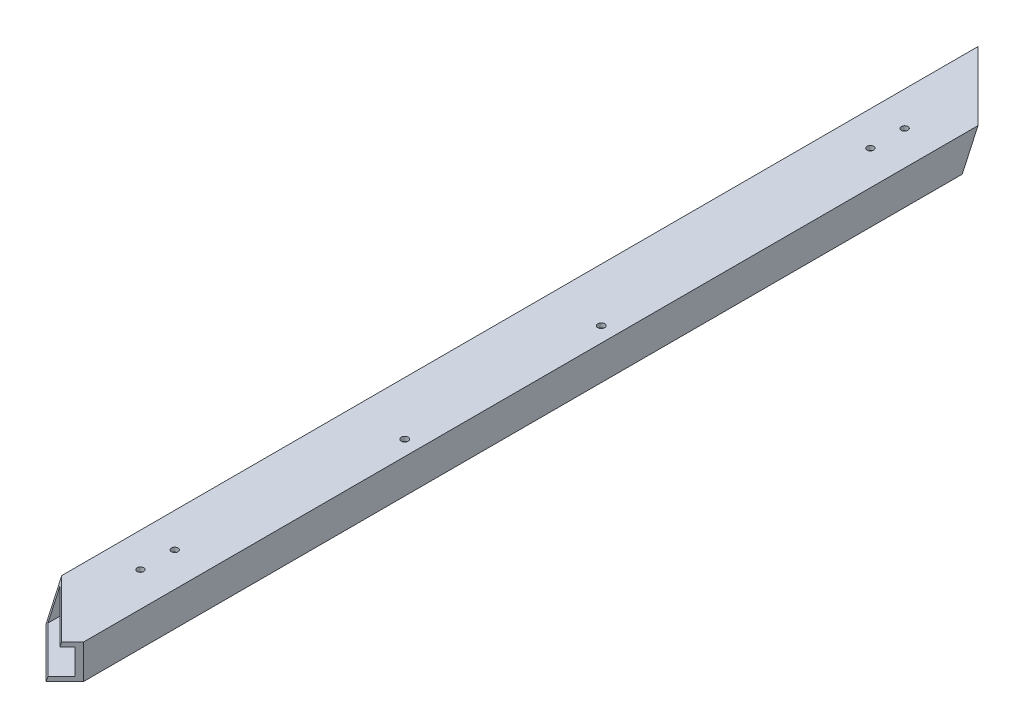
from build123d import *

# Parameters (mm, degrees)
SKETCH1_W                        = 50.8
SKETCH1_H                        = 25.4
SKETCH1_W_2                      = 44.45
SKETCH1_H_2                      = 19.05
BOSS_EXTRUDE1_DEPTH              = 771.9314
CUT_EXTRUDE1_DEPTH               = 771.9314
CUT_EXTRUDE2_DEPTH               = 773.76672179
CUT_EXTRUDE3_DEPTH               = 757.919388013
CUT_EXTRUDE5_DEPTH               = 771.9314
SKETCH7_R                        = 2.4638
CUT_EXTRUDE6_DEPTH               = 730.251464289
SKETCH8_R                        = 2.4638
CUT_EXTRUDE7_DEPTH               = 730.251464289
F_13_64_0_20313_DIAMETER_HOLE1_D = 5.159502


with BuildPart() as part:
    # Sketch1 → Boss-Extrude1 (new body)
    with BuildSketch(Plane.XY):
        Rectangle(SKETCH1_W, SKETCH1_H)
        Rectangle(SKETCH1_W_2, SKETCH1_H_2, mode=Mode.SUBTRACT)
    extrude(amount=BOSS_EXTRUDE1_DEPTH)

    # Sketch2 → Cut-Extrude1 (cut)
    with BuildSketch(Plane(origin=(0, 12.7, 0), x_dir=(1, 0, 0), z_dir=(0, 1, 0))):
        Polygon((-25.4, 0), (25.4, -50.8), (25.4, 0), align=None)
        Polygon((25.4, -771.9314), (-25.4, -721.1314), (-25.4, -771.9314), align=None)
    extrude(amount=-CUT_EXTRUDE1_DEPTH, mode=Mode.SUBTRACT)

    # Sketch3 → Cut-Extrude2 (cut, through all)
    with BuildSketch(Plane(origin=(0, 12.7, 0), x_dir=(1, 0, 0), z_dir=(0, 1, 0))):
        Polygon((-3.3782, -743.1532), (25.4, -714.375), (25.4, -771.9314), (-3.3782, -771.9314), align=None)
    extrude(amount=-CUT_EXTRUDE2_DEPTH, mode=Mode.SUBTRACT)

    # Sketch4 → Cut-Extrude3 (cut, through all)
    with BuildSketch(Plane(origin=(-12.7, 0, -12.7), x_dir=(0, -1, 0), z_dir=(0.7071067811865571, 0, 0.707106781186538))):
        Polygon((-12.7, -17.960512242), (12.7, -26.213472526), (12.7, -17.960512242), align=None)
    extrude(amount=CUT_EXTRUDE3_DEPTH, mode=Mode.SUBTRACT)

    # Sketch6 → Cut-Extrude5 (cut)
    with BuildSketch(Plane(origin=(369.8875, 0, 369.8875), x_dir=(0.7071067811865437, 0, -0.7071067811865513), z_dir=(0.7071067811865513, 0, 0.7071067811865437))):
        Polygon((-506.965494568, -12.7), (-498.712534284, 12.7), (-506.965494568, 12.7), (-527.877415309, 12.7), (-527.877415309, -12.7), align=None)
    extrude(amount=-CUT_EXTRUDE5_DEPTH, mode=Mode.SUBTRACT)

    # Sketch7 → Cut-Extrude6 (cut, through all)
    with BuildSketch(Plane.XZ.offset(12.7)):
        with Locations(Location((0, 105.257676555, 0), (0, 0, 270))):
            Circle(SKETCH7_R)
        with Locations(Location((0, 79.857676555, 0), (0, 0, 270))):
            Circle(SKETCH7_R)
    extrude(amount=-CUT_EXTRUDE6_DEPTH, mode=Mode.SUBTRACT)

    # Sketch8 → Cut-Extrude7 (cut, through all)
    with BuildSketch(Plane(origin=(0, 12.7, 0), x_dir=(1, 0, 0), z_dir=(0, 1, 0))):
        with Locations(Location((0, -646.867704494, 0), (0, 0, 270))):
            Circle(SKETCH8_R)
        with Locations(Location((0, -621.467704494, 0), (0, 0, 270))):
            Circle(SKETCH8_R)
    extrude(amount=-CUT_EXTRUDE7_DEPTH, mode=Mode.SUBTRACT)

    # 13/64 (0.20313) Diameter Hole1 (through all)
    with Locations(Plane(origin=(0, -12.7, 0), x_dir=(-1, 0, 0), z_dir=(0, -1, 0))):
        with Locations((-14.2367, -319.172239037), (-14.2367, -464.968239037)):
            Hole(F_13_64_0_20313_DIAMETER_HOLE1_D / 2)


solid = part.part
